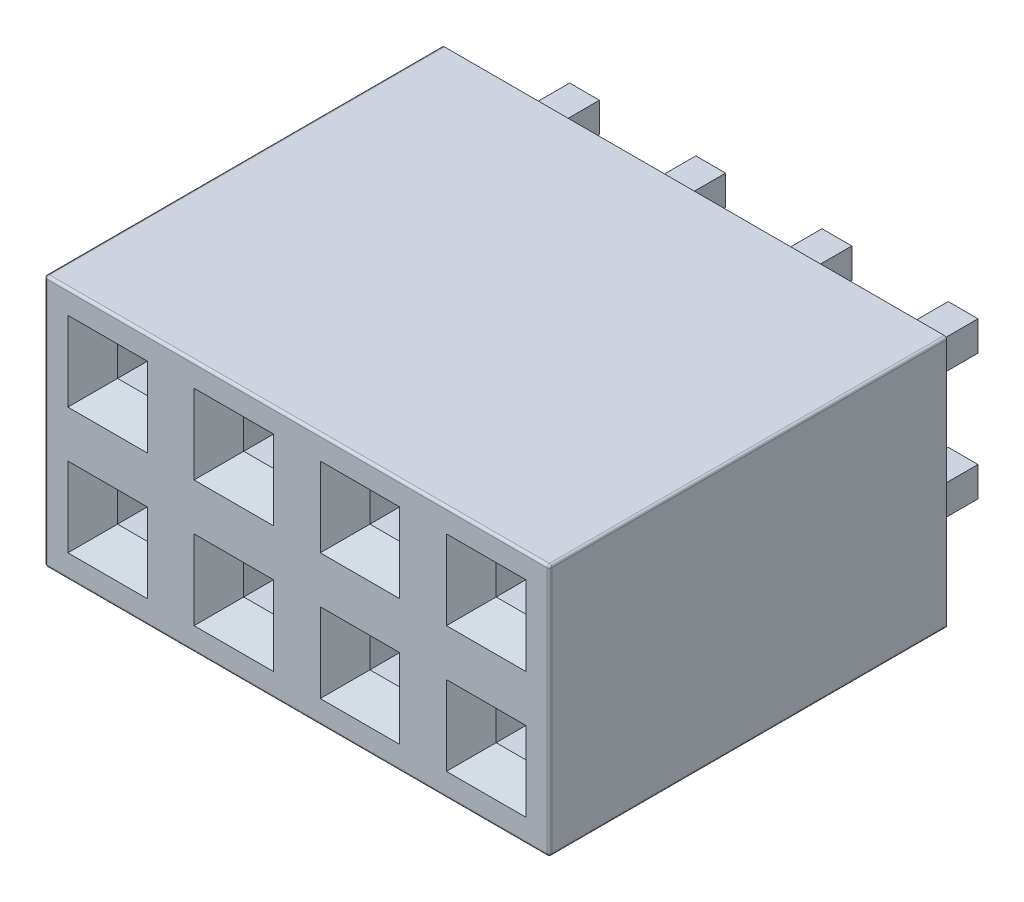
from build123d import *

# Parameters (mm, degrees)
SKETCH_1_W                  = 10.16
SKETCH_1_H                  = 5.08
EXTRUDE_1_DEPTH             = 8
SKETCH_2_W                  = 0.6
SKETCH_2_H                  = 0.6
CUT_EXTRUDE_1_DEPTH         = 5
SKETCH_3_W                  = 0.6
SKETCH_3_H                  = 0.6
EXTRUDE_2_DEPTH             = 1.6
PATTERN_LINEAR_1_COUNT      = 4
PATTERN_LINEAR_1_PITCH      = 2.54
PATTERN_LINEAR_1_COUNT_DIR2 = 2
PATTERN_LINEAR_1_PITCH_DIR2 = 2.54
CHAMFER_1_SIZE              = 0.5
CHAMFER_2_SIZE              = 0.5
FILLET_1_R                  = 0.05


with BuildPart() as part:
    # 草图1 → 凸台-拉伸1 (new body)
    with BuildSketch(Plane.XY):
        Rectangle(SKETCH_1_W, SKETCH_1_H)
    extrude(amount=EXTRUDE_1_DEPTH)

    # 草图2 → 切除-拉伸1 (cut)
    with BuildSketch(Plane.XY.offset(8)):
        with Locations((1.27, 1.27)):
            Rectangle(SKETCH_2_W, SKETCH_2_H)
        with Locations((-1.27, 1.27)):
            Rectangle(SKETCH_2_W, SKETCH_2_H)
        with Locations((3.81, 1.27)):
            Rectangle(SKETCH_2_W, SKETCH_2_H)
        with Locations((-1.27, -1.27)):
            Rectangle(SKETCH_2_W, SKETCH_2_H)
        with Locations((1.27, -1.27)):
            Rectangle(SKETCH_2_W, SKETCH_2_H)
        with Locations((3.81, -1.27)):
            Rectangle(SKETCH_2_W, SKETCH_2_H)
        with Locations((-3.81, -1.27)):
            Rectangle(SKETCH_2_W, SKETCH_2_H)
        with Locations((-3.81, 1.27)):
            Rectangle(SKETCH_2_W, SKETCH_2_H)
    extrude(amount=-CUT_EXTRUDE_1_DEPTH, mode=Mode.SUBTRACT)


with BuildPart() as body_2:
    # 草图3 → 凸台-拉伸2 (new body)
    with BuildSketch(Plane(origin=(0, 0, 0), x_dir=(-1, 0, 0), z_dir=(0, 0, -1))):
        with Locations((3.81, -1.27)):
            Rectangle(SKETCH_3_W, SKETCH_3_H)
    extrude_2 = extrude(amount=EXTRUDE_2_DEPTH)


with BuildPart() as part_1:
    add(part.part)

    # 阵列(线性)1: Extrude 2 4 × 2
    with Locations(*[(i * PATTERN_LINEAR_1_PITCH, j * PATTERN_LINEAR_1_PITCH_DIR2, 0) for i in range(PATTERN_LINEAR_1_COUNT) for j in range(PATTERN_LINEAR_1_COUNT_DIR2) if (i, j) != (0, 0)]):
        add(extrude_2)

    # 倒角1
    chamfer_1_edges = [part_1.edges().sort_by_distance(p)[0] for p in [
        (4.11, -1.27, 8),
        (3.81, -0.97, 8),
        (3.51, -1.27, 8),
        (3.81, -1.57, 8),
    ]]
    chamfer(chamfer_1_edges, length=CHAMFER_1_SIZE)

    # 倒角2
    chamfer_2_edges = [part_1.edges().sort_by_distance(p)[0] for p in [
        (-0.97, 1.27, 8),
        (-1.27, 1.57, 8),
        (-1.57, 1.27, 8),
        (-1.27, 0.97, 8),
        (1.57, 1.27, 8),
        (1.27, 1.57, 8),
        (0.97, 1.27, 8),
        (1.27, 0.97, 8),
        (-3.81, -0.97, 8),
        (-4.11, -1.27, 8),
        (-3.81, -1.57, 8),
        (-3.51, -1.27, 8),
        (4.11, 1.27, 8),
        (3.81, 1.57, 8),
        (3.51, 1.27, 8),
        (3.81, 0.97, 8),
        (-0.97, -1.27, 8),
        (-1.27, -0.97, 8),
        (-1.57, -1.27, 8),
        (-1.27, -1.57, 8),
        (1.57, -1.27, 8),
        (1.27, -0.97, 8),
        (0.97, -1.27, 8),
        (1.27, -1.57, 8),
        (-3.81, 1.57, 8),
        (-4.11, 1.27, 8),
        (-3.81, 0.97, 8),
        (-3.51, 1.27, 8),
    ]]
    chamfer(chamfer_2_edges, length=CHAMFER_2_SIZE)

    # 圆角1
    fillet_1_edges = [part_1.edges().sort_by_distance(p)[0] for p in [
        (-5.08, 0, 8),
        (0, -2.54, 8),
        (5.08, 0, 8),
        (0, 2.54, 8),
        (5.08, -2.54, 4),
        (-5.08, -2.54, 4),
        (-5.08, 2.54, 4),
        (5.08, 2.54, 4),
    ]]
    fillet(fillet_1_edges, radius=FILLET_1_R)


solid = Compound([body_2.part, part_1.part])
